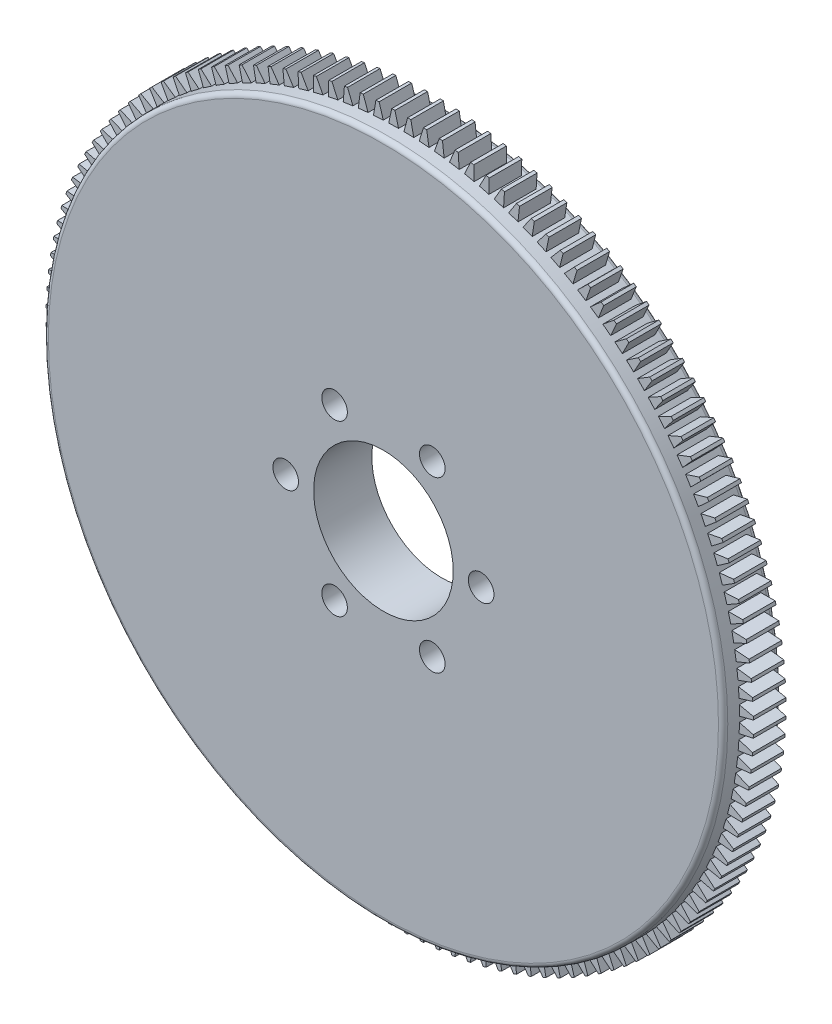
from build123d import *

# Parameters (mm, degrees)
SKETCH2_W                   = 4.5
SKETCH2_H                   = 56
RING_START                  = -440
SKETCH3_R                   = 120
RING_GEAR_DEPTH             = 14
CRANK_BOLT_HOLES_DEPTH      = 494.290608141
CRANK_BOLT_HOLES_DEPTH_BACK = 494.290608141
SKETCH4_R                   = 5.5


with BuildPart() as part:
    # Sketch1 → Plate (revolve)
    with BuildSketch(Plane(origin=(0, 0, 0), x_dir=(0, 0, -1), z_dir=(1, 0, 0)), mode=Mode.PRIVATE) as plate_sk:
        with BuildLine():
            Line((419, 30), (419, 144))
            ThreePointArc((419, 144), (419.585786438, 145.414213562), (421, 146))
            Line((421, 146), (442, 146))
            ThreePointArc((442, 146), (443.414213562, 145.414213562), (444, 144))
            Line((444, 144), (444, 30))
            Line((444, 30), (419, 30))
        make_face()
    revolve(plate_sk.sketch.rotate(Axis((0, 0, -400), (0, 0, -1)), 90), axis=Axis((0, 0, -400), (0, 0, -1)))

    # Sketch2 → Clutch Face (revolve, cut)
    with BuildSketch(Plane(origin=(0, 0, 0), x_dir=(0, 0, -1), z_dir=(1, 0, 0)), mode=Mode.PRIVATE) as clutch_face_sk:
        with Locations((443.75, 108)):
            Rectangle(SKETCH2_W, SKETCH2_H)
    revolve(clutch_face_sk.sketch.rotate(Axis((0, 0, -400), (0, 0, -1)), 90), axis=Axis((0, 0, -400), (0, 0, -1)), mode=Mode.SUBTRACT)

    # Sketch3 → Ring Gear (add)
    with BuildSketch(Plane.XY.offset(RING_START)):
        Polygon((144, 0), (151.986223046, 2.046461383), (151.961731711, 3.410585773), (143.907195405, 5.169053179), (143.855001582, 6.46053557), (151.74136889, 8.863236845), (151.655701007, 10.224888853), (143.530381741, 11.620220195), (143.420298335, 12.908060482), (151.190927811, 15.662162928), (151.044255904, 17.018600368), (142.864516989, 18.047985633), (142.696765695, 19.329590278), (150.336008325, 22.429547499), (150.12862777, 23.778038686), (141.910942113, 24.43940483), (141.685860758, 25.712192851), (149.178332124, 29.151761946), (148.91066056, 30.489591199), (140.671577486, 30.781606319), (140.389619354, 32.04301449), (147.720230616, 35.815268624), (147.392807097, 37.139741733), (139.148919023, 37.061817749), (138.81065194, 38.309305762), (145.964640223, 42.406648118), (145.578124136, 43.71509777), (137.346033155, 43.26739161), (136.952138347, 44.49844719), (143.915096469, 48.912626266), (143.470266207, 50.202417417), (135.266550654, 49.385830702), (134.817821372, 50.597974668), (141.575726864, 55.320100894), (141.073478255, 56.588636077), (132.914659322, 55.404813304), (132.411999247, 56.595604558), (138.951242586, 61.616168201), (138.392587092, 62.860892755), (130.295095555, 61.312217985), (129.739516978, 62.479258433), (136.046928998, 67.788148745), (135.432991677, 69.00655596), (127.413134806, 67.096148019), (126.805756587, 68.237087396), (132.868635, 73.823612979), (132.20065224, 75.013249146), (124.274580959, 72.74495534), (123.616626279, 73.857495946), (129.422761253, 79.710406281), (128.702078283, 80.86887563), (120.885754645, 78.247264002), (120.178548536, 79.329165329), (125.71624729, 85.436673434), (124.944315468, 86.561642962), (117.253480509, 83.591993088), (116.49844719, 84.64107633), (121.756557535, 90.990882495), (120.93493143, 92.080086664), (113.385073468, 88.768379025), (112.583733475, 89.782531468), (117.551666277, 96.361848029), (116.682000534, 97.413093326), (109.288323978, 93.765997259), (108.442291105, 94.743176535), (113.110041607, 101.538753625), (112.194087618, 102.549922982), (104.971482349, 98.574783254), (104.082460391, 99.513021454), (108.440628366, 106.511173684), (107.48023074, 107.48023074), (100.443242123, 103.185052754), (99.513021454, 104.082460391), (103.552830131, 111.269094415), (102.549922982, 112.194087618), (95.712722576, 107.587521289), (94.743176535, 108.442291105), (98.456490277, 115.802933997), (97.413093326, 116.682000534), (90.789450342, 111.773322875), (89.782531468, 112.583733475), (93.161872155, 120.103561881), (92.080086664, 120.93493143), (85.683340239, 115.734027864), (84.64107633, 116.49844719), (87.679638421, 124.162317176), (86.561642962, 124.944315468), (80.404675291, 119.461659922), (79.329165329, 120.178548536), (82.020829563, 127.971026087), (80.86887563, 128.702078283), (74.964086027, 122.948712096), (73.857495946, 123.616626279), (76.19684167, 131.522018383), (75.013249146, 132.20065224), (69.372529071, 126.188161926), (68.237087396, 126.805756587), (70.219403479, 134.808142837), (69.00655596, 135.432991677), (63.641265073, 129.173485592), (62.479258433, 129.739516978), (64.100552754, 137.822781631), (62.860892755, 138.392587092), (57.781836037, 131.898671048), (56.595604558, 132.411999247), (57.852612046, 140.559863686), (56.588636077, 141.073478255), (51.806042073, 134.358230134), (50.597974668, 134.817821372), (51.488163877, 143.013876881), (50.202417417, 143.470266207), (45.725917635, 136.547209625), (44.49844719, 136.952138347), (45.020025398, 145.179879161), (43.71509777, 145.578124136), (39.553707284, 138.461201209), (38.309305762, 138.81065194), (38.46122258, 147.053508485), (37.139741733, 147.392807097), (33.30184103, 140.096350359), (32.04301449, 140.389619354), (31.824963977, 148.630991613), (30.489591199, 148.91066056), (26.9829093, 141.449364105), (25.712192851, 141.685860758), (25.124614132, 149.909151704), (23.778038686, 150.12862777), (20.609637582, 142.517517656), (19.329590278, 142.696765695), (18.373666659, 150.885414714), (17.018600368, 151.044255904), (14.194860797, 143.298659892), (12.908060482, 143.420298335), (11.585717065, 151.557814579), (10.224888853, 151.655701007), (7.751497451, 143.791217699), (6.46053557, 143.855001582), (4.77443538, 151.924997176), (3.410585773, 151.961731711), (1.292523621, 143.994199129), (0, 144), (-2.046461383, 151.986223046), (-3.410585773, 151.961731711), (-5.169053179, 143.907195405), (-6.46053557, 143.855001582), (-8.863236845, 151.74136889), (-10.224888853, 151.655701007), (-11.620220195, 143.530381741), (-12.908060482, 143.420298335), (-15.662162928, 151.190927811), (-17.018600368, 151.044255904), (-18.047985633, 142.864516989), (-19.329590278, 142.696765695), (-22.429547499, 150.336008325), (-23.778038686, 150.12862777), (-24.43940483, 141.910942113), (-25.712192851, 141.685860758), (-29.151761946, 149.178332124), (-30.489591199, 148.91066056), (-30.781606319, 140.671577486), (-32.04301449, 140.389619354), (-35.815268624, 147.720230616), (-37.139741733, 147.392807097), (-37.061817749, 139.148919023), (-38.309305762, 138.81065194), (-42.406648118, 145.964640223), (-43.71509777, 145.578124136), (-43.26739161, 137.346033155), (-44.49844719, 136.952138347), (-48.912626266, 143.915096469), (-50.202417417, 143.470266207), (-49.385830702, 135.266550654), (-50.597974668, 134.817821372), (-55.320100894, 141.575726864), (-56.588636077, 141.073478255), (-55.404813304, 132.914659322), (-56.595604558, 132.411999247), (-61.616168201, 138.951242586), (-62.860892755, 138.392587092), (-61.312217985, 130.295095555), (-62.479258433, 129.739516978), (-67.788148745, 136.046928998), (-69.00655596, 135.432991677), (-67.096148019, 127.413134806), (-68.237087396, 126.805756587), (-73.823612979, 132.868635), (-75.013249146, 132.20065224), (-72.74495534, 124.274580959), (-73.857495946, 123.616626279), (-79.710406281, 129.422761253), (-80.86887563, 128.702078283), (-78.247264002, 120.885754645), (-79.329165329, 120.178548536), (-85.436673434, 125.71624729), (-86.561642962, 124.944315468), (-83.591993088, 117.253480509), (-84.64107633, 116.49844719), (-90.990882495, 121.756557535), (-92.080086664, 120.93493143), (-88.768379025, 113.385073468), (-89.782531468, 112.583733475), (-96.361848029, 117.551666277), (-97.413093326, 116.682000534), (-93.765997259, 109.288323978), (-94.743176535, 108.442291105), (-101.538753625, 113.110041607), (-102.549922982, 112.194087618), (-98.574783254, 104.971482349), (-99.513021454, 104.082460391), (-106.511173684, 108.440628366), (-107.48023074, 107.48023074), (-103.185052754, 100.443242123), (-104.082460391, 99.513021454), (-111.269094415, 103.552830131), (-112.194087618, 102.549922982), (-107.587521289, 95.712722576), (-108.442291105, 94.743176535), (-115.802933997, 98.456490277), (-116.682000534, 97.413093326), (-111.773322875, 90.789450342), (-112.583733475, 89.782531468), (-120.103561881, 93.161872155), (-120.93493143, 92.080086664), (-115.734027864, 85.683340239), (-116.49844719, 84.64107633), (-124.162317176, 87.679638421), (-124.944315468, 86.561642962), (-119.461659922, 80.404675291), (-120.178548536, 79.329165329), (-127.971026087, 82.020829563), (-128.702078283, 80.86887563), (-122.948712096, 74.964086027), (-123.616626279, 73.857495946), (-131.522018383, 76.19684167), (-132.20065224, 75.013249146), (-126.188161926, 69.372529071), (-126.805756587, 68.237087396), (-134.808142837, 70.219403479), (-135.432991677, 69.00655596), (-129.173485592, 63.641265073), (-129.739516978, 62.479258433), (-137.822781631, 64.100552754), (-138.392587092, 62.860892755), (-131.898671048, 57.781836037), (-132.411999247, 56.595604558), (-140.559863686, 57.852612046), (-141.073478255, 56.588636077), (-134.358230134, 51.806042073), (-134.817821372, 50.597974668), (-143.013876881, 51.488163877), (-143.470266207, 50.202417417), (-136.547209625, 45.725917635), (-136.952138347, 44.49844719), (-145.179879161, 45.020025398), (-145.578124136, 43.71509777), (-138.461201209, 39.553707284), (-138.81065194, 38.309305762), (-147.053508485, 38.46122258), (-147.392807097, 37.139741733), (-140.096350359, 33.30184103), (-140.389619354, 32.04301449), (-148.630991613, 31.824963977), (-148.91066056, 30.489591199), (-141.449364105, 26.9829093), (-141.685860758, 25.712192851), (-149.909151704, 25.124614132), (-150.12862777, 23.778038686), (-142.517517656, 20.609637582), (-142.696765695, 19.329590278), (-150.885414714, 18.373666659), (-151.044255904, 17.018600368), (-143.298659892, 14.194860797), (-143.420298335, 12.908060482), (-151.557814579, 11.585717065), (-151.655701007, 10.224888853), (-143.791217699, 7.751497451), (-143.855001582, 6.46053557), (-151.924997176, 4.77443538), (-151.961731711, 3.410585773), (-143.994199129, 1.292523621), (-144, 0), (-151.986223046, -2.046461383), (-151.961731711, -3.410585773), (-143.907195405, -5.169053179), (-143.855001582, -6.46053557), (-151.74136889, -8.863236845), (-151.655701007, -10.224888853), (-143.530381741, -11.620220195), (-143.420298335, -12.908060482), (-151.190927811, -15.662162928), (-151.044255904, -17.018600368), (-142.864516989, -18.047985633), (-142.696765695, -19.329590278), (-150.336008325, -22.429547499), (-150.12862777, -23.778038686), (-141.910942113, -24.43940483), (-141.685860758, -25.712192851), (-149.178332124, -29.151761946), (-148.91066056, -30.489591199), (-140.671577486, -30.781606319), (-140.389619354, -32.04301449), (-147.720230616, -35.815268624), (-147.392807097, -37.139741733), (-139.148919023, -37.061817749), (-138.81065194, -38.309305762), (-145.964640223, -42.406648118), (-145.578124136, -43.71509777), (-137.346033155, -43.26739161), (-136.952138347, -44.49844719), (-143.915096469, -48.912626266), (-143.470266207, -50.202417417), (-135.266550654, -49.385830702), (-134.817821372, -50.597974668), (-141.575726864, -55.320100894), (-141.073478255, -56.588636077), (-132.914659322, -55.404813304), (-132.411999247, -56.595604558), (-138.951242586, -61.616168201), (-138.392587092, -62.860892755), (-130.295095555, -61.312217985), (-129.739516978, -62.479258433), (-136.046928998, -67.788148745), (-135.432991677, -69.00655596), (-127.413134806, -67.096148019), (-126.805756587, -68.237087396), (-132.868635, -73.823612979), (-132.20065224, -75.013249146), (-124.274580959, -72.74495534), (-123.616626279, -73.857495946), (-129.422761253, -79.710406281), (-128.702078283, -80.86887563), (-120.885754645, -78.247264002), (-120.178548536, -79.329165329), (-125.71624729, -85.436673434), (-124.944315468, -86.561642962), (-117.253480509, -83.591993088), (-116.49844719, -84.64107633), (-121.756557535, -90.990882495), (-120.93493143, -92.080086664), (-113.385073468, -88.768379025), (-112.583733475, -89.782531468), (-117.551666277, -96.361848029), (-116.682000534, -97.413093326), (-109.288323978, -93.765997259), (-108.442291105, -94.743176535), (-113.110041607, -101.538753625), (-112.194087618, -102.549922982), (-104.971482349, -98.574783254), (-104.082460391, -99.513021454), (-108.440628366, -106.511173684), (-107.48023074, -107.48023074), (-100.443242123, -103.185052754), (-99.513021454, -104.082460391), (-103.552830131, -111.269094415), (-102.549922982, -112.194087618), (-95.712722576, -107.587521289), (-94.743176535, -108.442291105), (-98.456490277, -115.802933997), (-97.413093326, -116.682000534), (-90.789450342, -111.773322875), (-89.782531468, -112.583733475), (-93.161872155, -120.103561881), (-92.080086664, -120.93493143), (-85.683340239, -115.734027864), (-84.64107633, -116.49844719), (-87.679638421, -124.162317176), (-86.561642962, -124.944315468), (-80.404675291, -119.461659922), (-79.329165329, -120.178548536), (-82.020829563, -127.971026087), (-80.86887563, -128.702078283), (-74.964086027, -122.948712096), (-73.857495946, -123.616626279), (-76.19684167, -131.522018383), (-75.013249146, -132.20065224), (-69.372529071, -126.188161926), (-68.237087396, -126.805756587), (-70.219403479, -134.808142837), (-69.00655596, -135.432991677), (-63.641265073, -129.173485592), (-62.479258433, -129.739516978), (-64.100552754, -137.822781631), (-62.860892755, -138.392587092), (-57.781836037, -131.898671048), (-56.595604558, -132.411999247), (-57.852612046, -140.559863686), (-56.588636077, -141.073478255), (-51.806042073, -134.358230134), (-50.597974668, -134.817821372), (-51.488163877, -143.013876881), (-50.202417417, -143.470266207), (-45.725917635, -136.547209625), (-44.49844719, -136.952138347), (-45.020025398, -145.179879161), (-43.71509777, -145.578124136), (-39.553707284, -138.461201209), (-38.309305762, -138.81065194), (-38.46122258, -147.053508485), (-37.139741733, -147.392807097), (-33.30184103, -140.096350359), (-32.04301449, -140.389619354), (-31.824963977, -148.630991613), (-30.489591199, -148.91066056), (-26.9829093, -141.449364105), (-25.712192851, -141.685860758), (-25.124614132, -149.909151704), (-23.778038686, -150.12862777), (-20.609637582, -142.517517656), (-19.329590278, -142.696765695), (-18.373666659, -150.885414714), (-17.018600368, -151.044255904), (-14.194860797, -143.298659892), (-12.908060482, -143.420298335), (-11.585717065, -151.557814579), (-10.224888853, -151.655701007), (-7.751497451, -143.791217699), (-6.46053557, -143.855001582), (-4.77443538, -151.924997176), (-3.410585773, -151.961731711), (-1.292523621, -143.994199129), (0, -144), (2.046461383, -151.986223046), (3.410585773, -151.961731711), (5.169053179, -143.907195405), (6.46053557, -143.855001582), (8.863236845, -151.74136889), (10.224888853, -151.655701007), (11.620220195, -143.530381741), (12.908060482, -143.420298335), (15.662162928, -151.190927811), (17.018600368, -151.044255904), (18.047985633, -142.864516989), (19.329590278, -142.696765695), (22.429547499, -150.336008325), (23.778038686, -150.12862777), (24.43940483, -141.910942113), (25.712192851, -141.685860758), (29.151761946, -149.178332124), (30.489591199, -148.91066056), (30.781606319, -140.671577486), (32.04301449, -140.389619354), (35.815268624, -147.720230616), (37.139741733, -147.392807097), (37.061817749, -139.148919023), (38.309305762, -138.81065194), (42.406648118, -145.964640223), (43.71509777, -145.578124136), (43.26739161, -137.346033155), (44.49844719, -136.952138347), (48.912626266, -143.915096469), (50.202417417, -143.470266207), (49.385830702, -135.266550654), (50.597974668, -134.817821372), (55.320100894, -141.575726864), (56.588636077, -141.073478255), (55.404813304, -132.914659322), (56.595604558, -132.411999247), (61.616168201, -138.951242586), (62.860892755, -138.392587092), (61.312217985, -130.295095555), (62.479258433, -129.739516978), (67.788148745, -136.046928998), (69.00655596, -135.432991677), (67.096148019, -127.413134806), (68.237087396, -126.805756587), (73.823612979, -132.868635), (75.013249146, -132.20065224), (72.74495534, -124.274580959), (73.857495946, -123.616626279), (79.710406281, -129.422761253), (80.86887563, -128.702078283), (78.247264002, -120.885754645), (79.329165329, -120.178548536), (85.436673434, -125.71624729), (86.561642962, -124.944315468), (83.591993088, -117.253480509), (84.64107633, -116.49844719), (90.990882495, -121.756557535), (92.080086664, -120.93493143), (88.768379025, -113.385073468), (89.782531468, -112.583733475), (96.361848029, -117.551666277), (97.413093326, -116.682000534), (93.765997259, -109.288323978), (94.743176535, -108.442291105), (101.538753625, -113.110041607), (102.549922982, -112.194087618), (98.574783254, -104.971482349), (99.513021454, -104.082460391), (106.511173684, -108.440628366), (107.48023074, -107.48023074), (103.185052754, -100.443242123), (104.082460391, -99.513021454), (111.269094415, -103.552830131), (112.194087618, -102.549922982), (107.587521289, -95.712722576), (108.442291105, -94.743176535), (115.802933997, -98.456490277), (116.682000534, -97.413093326), (111.773322875, -90.789450342), (112.583733475, -89.782531468), (120.103561881, -93.161872155), (120.93493143, -92.080086664), (115.734027864, -85.683340239), (116.49844719, -84.64107633), (124.162317176, -87.679638421), (124.944315468, -86.561642962), (119.461659922, -80.404675291), (120.178548536, -79.329165329), (127.971026087, -82.020829563), (128.702078283, -80.86887563), (122.948712096, -74.964086027), (123.616626279, -73.857495946), (131.522018383, -76.19684167), (132.20065224, -75.013249146), (126.188161926, -69.372529071), (126.805756587, -68.237087396), (134.808142837, -70.219403479), (135.432991677, -69.00655596), (129.173485592, -63.641265073), (129.739516978, -62.479258433), (137.822781631, -64.100552754), (138.392587092, -62.860892755), (131.898671048, -57.781836037), (132.411999247, -56.595604558), (140.559863686, -57.852612046), (141.073478255, -56.588636077), (134.358230134, -51.806042073), (134.817821372, -50.597974668), (143.013876881, -51.488163877), (143.470266207, -50.202417417), (136.547209625, -45.725917635), (136.952138347, -44.49844719), (145.179879161, -45.020025398), (145.578124136, -43.71509777), (138.461201209, -39.553707284), (138.81065194, -38.309305762), (147.053508485, -38.46122258), (147.392807097, -37.139741733), (140.096350359, -33.30184103), (140.389619354, -32.04301449), (148.630991613, -31.824963977), (148.91066056, -30.489591199), (141.449364105, -26.9829093), (141.685860758, -25.712192851), (149.909151704, -25.124614132), (150.12862777, -23.778038686), (142.517517656, -20.609637582), (142.696765695, -19.329590278), (150.885414714, -18.373666659), (151.044255904, -17.018600368), (143.298659892, -14.194860797), (143.420298335, -12.908060482), (151.557814579, -11.585717065), (151.655701007, -10.224888853), (143.791217699, -7.751497451), (143.855001582, -6.46053557), (151.924997176, -4.77443538), (151.961731711, -3.410585773), (143.994199129, -1.292523621), align=None)
        Circle(SKETCH3_R, mode=Mode.SUBTRACT)
    extrude(amount=RING_GEAR_DEPTH)

    # Sketch4 → Crank Bolt Holes (cut, two sides: drawn at the far end of the back side and taken through both)
    with BuildSketch(Plane.XY.offset(-CRANK_BOLT_HOLES_DEPTH_BACK)):
        with Locations((42, 0)):
            Circle(SKETCH4_R)
        with Locations((21, 36.373066959)):
            Circle(SKETCH4_R)
        with Locations((-21, 36.373066959)):
            Circle(SKETCH4_R)
        with Locations((-42, 0)):
            Circle(SKETCH4_R)
        with Locations((-21, -36.373066959)):
            Circle(SKETCH4_R)
        with Locations((21, -36.373066959)):
            Circle(SKETCH4_R)
    extrude(amount=CRANK_BOLT_HOLES_DEPTH + CRANK_BOLT_HOLES_DEPTH_BACK, mode=Mode.SUBTRACT)


solid = part.part
